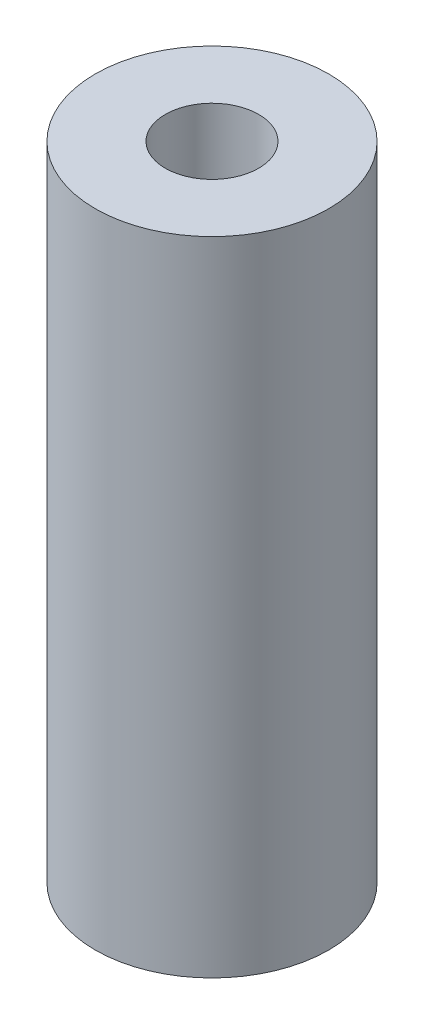
from build123d import *

# Parameters (mm, degrees)
SKETCH1_R            = 6
BOSS_EXTRUDE1_DEPTH  = 33
M4_CLEARANCE_HOLE1_D = 4.8


with BuildPart() as part:
    # Sketch1 → Boss-Extrude1 (new body)
    with BuildSketch(Plane(origin=(0, 0, 0), x_dir=(1, 0, 0), z_dir=(0, 1, 0))):
        with Locations(Location((0, 0, 0), (0, 0, 270))):
            Circle(SKETCH1_R)
    extrude(amount=BOSS_EXTRUDE1_DEPTH)

    # M4 Clearance Hole1 (through all)
    with Locations(Plane.ZX.offset(33)):
        with Locations((0, 0)):
            Hole(M4_CLEARANCE_HOLE1_D / 2)


solid = part.part
